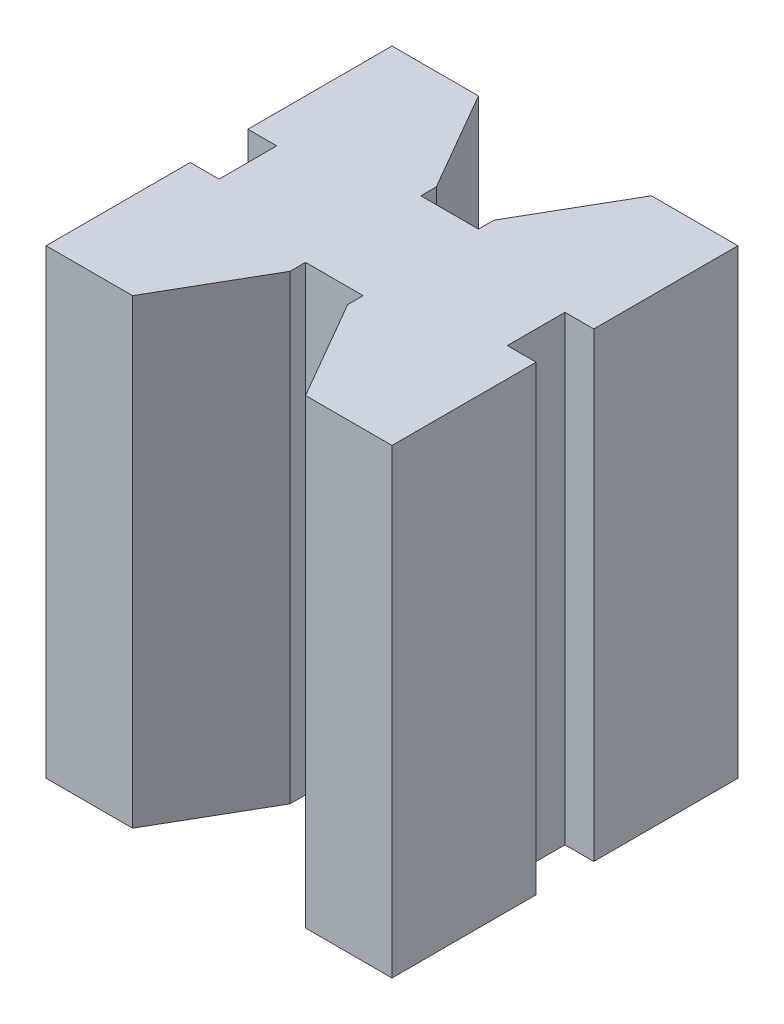
from build123d import *

# Parameters (mm, degrees)
BOSS_EXTRUDE2_DEPTH = 40


with BuildPart() as part:
    # Sketch1 → Boss-Extrude2 (new body)
    with BuildSketch(Plane(origin=(0, 0, 0), x_dir=(1, 0, 0), z_dir=(0, 1, 0))):
        Polygon((-30, -12.5), (-27.5, -12.5), (-27.5, -17.5), (-30, -17.5), (-30, -30), (-22.5, -30), (-17.5, -21.339745962), (-17.5, -20), (-12.5, -20), (-12.5, -21.339745962), (-7.5, -30), (0, -30), (0, -17.5), (-2.5, -17.5), (-2.5, -12.5), (0, -12.5), (0, 0), (-7.5, 0), (-12.5, -8.660254038), (-12.5, -10), (-17.5, -10), (-17.5, -8.660254038), (-22.5, 0), (-30, 0), align=None)
    extrude(amount=BOSS_EXTRUDE2_DEPTH)


solid = part.part
